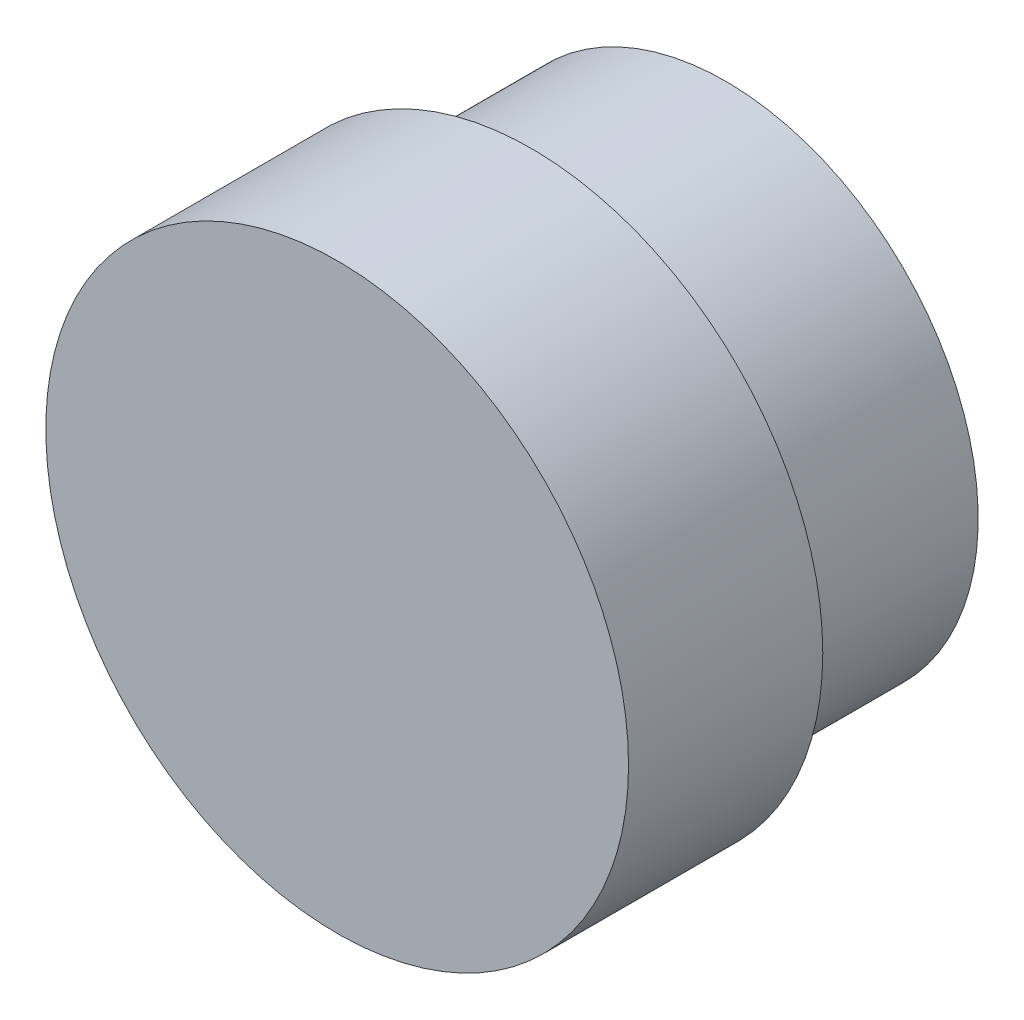
from build123d import *

# Parameters (mm, degrees)
SKETCH_5_W = 6.5
SKETCH_5_H = 5
SKETCH_7_W = 7.5
SKETCH_7_H = 5


with BuildPart() as part:
    # ｽｹｯﾁ5 → 回転4 (revolve)
    with BuildSketch(Plane(origin=(0, 0, 0), x_dir=(1, 0, 0), z_dir=(0, 1, 0))):
        with Locations((-3.25, -52.5)):
            Rectangle(SKETCH_5_W, SKETCH_5_H)
    revolve(axis=Axis((0, 0, 50), (0, 0, 1)))

    # ｽｹｯﾁ7 → 回転5 (revolve)
    with BuildSketch(Plane(origin=(0, 0, 0), x_dir=(1, 0, 0), z_dir=(0, 1, 0))):
        with Locations((3.75, -57.5)):
            Rectangle(SKETCH_7_W, SKETCH_7_H)
    revolve(axis=Axis((0, 0, 60), (0, 0, -1)))


solid = part.part
